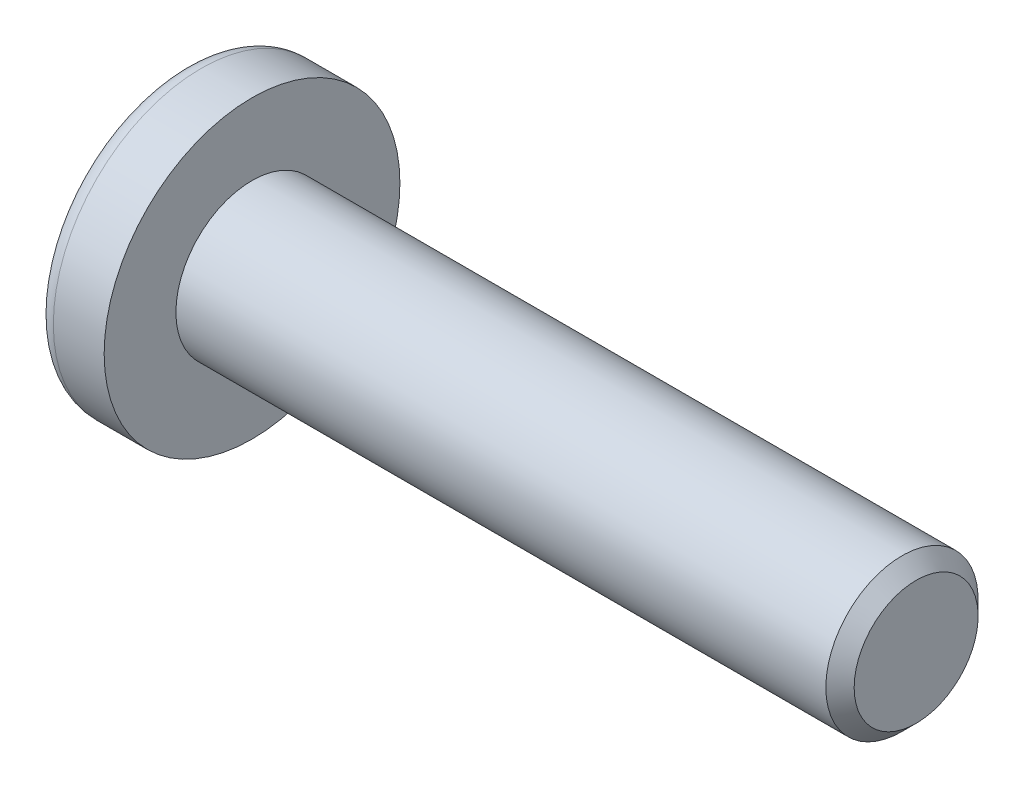
from build123d import *

# Parameters (mm, degrees)
CIRPATTERN1_COUNT = 2
CIRPATTERN1_ANGLE = 90
CHAMFER1_SIZE     = 0.2032


with BuildPart() as part:
    # BodySke → Base-Revolve (revolve)
    with BuildSketch(Plane.XY, mode=Mode.PRIVATE) as base_revolve_sk:
        with BuildLine():
            Line((1.5748, 1.0922), (1.5748, 2.1209))
            Line((1.5748, 2.1209), (0.845695803, 2.1209))
            ThreePointArc((0.845695803, 2.1209), (0.728748015, 2.09237553), (0.638066948, 2.013208777))
            ThreePointArc((0.638066948, 2.013208777), (0.163333253, 1.05595206), (0, 0))
            Line((0, 0), (11.0998, 0))
            Line((11.0998, 0), (11.0998, 1.0922))
            Line((11.0998, 1.0922), (1.5748, 1.0922))
        make_face()
    revolve(base_revolve_sk.sketch.rotate(Axis((-25.4, 0, 0), (1, 0, 0)), 90), axis=Axis((-25.4, 0, 0), (1, 0, 0)))

    # Sketch3 → Cut-Loft1 section 0
    with BuildSketch(Plane(origin=(0, 0, 0), x_dir=(0, 0, -1), z_dir=(1, 0, 0))):
        with BuildLine():
            Line((0.3429, -1.3843), (-0.3429, -1.3843))
            Line((-0.3429, -1.3843), (-0.3429, 1.3843))
            Line((-0.3429, 1.3843), (0.3429, 1.3843))
            Line((0.3429, 1.3843), (0.3429, -1.3843))
        make_face()
    # Sketch4 → Cut-Loft1 section 1
    with BuildSketch(Plane(origin=(1.4986, 0, 0), x_dir=(0, 0, -1), z_dir=(1, 0, 0))):
        with BuildLine():
            Line((0.17145, -0.17145), (-0.17145, -0.17145))
            Line((-0.17145, -0.17145), (-0.17145, 0.17145))
            Line((-0.17145, 0.17145), (0.17145, 0.17145))
            Line((0.17145, 0.17145), (0.17145, -0.17145))
        make_face()
    cut_loft1 = loft(mode=Mode.SUBTRACT)

    # CirPattern1: Cut-Loft1 ×2 about axis
    cirpattern1_axis = Axis((0, 0, 0), (1, 0, 0))
    for i in range(1, CIRPATTERN1_COUNT):
        add(cut_loft1.rotate(cirpattern1_axis, i * CIRPATTERN1_ANGLE / (CIRPATTERN1_COUNT - 1)), mode=Mode.SUBTRACT)

    # Chamfer1
    chamfer1_edges = [part.edges().sort_by_distance(p)[0] for p in [
        (11.0998, 0, -1.0922),
    ]]
    chamfer(chamfer1_edges, length=CHAMFER1_SIZE)


solid = part.part
